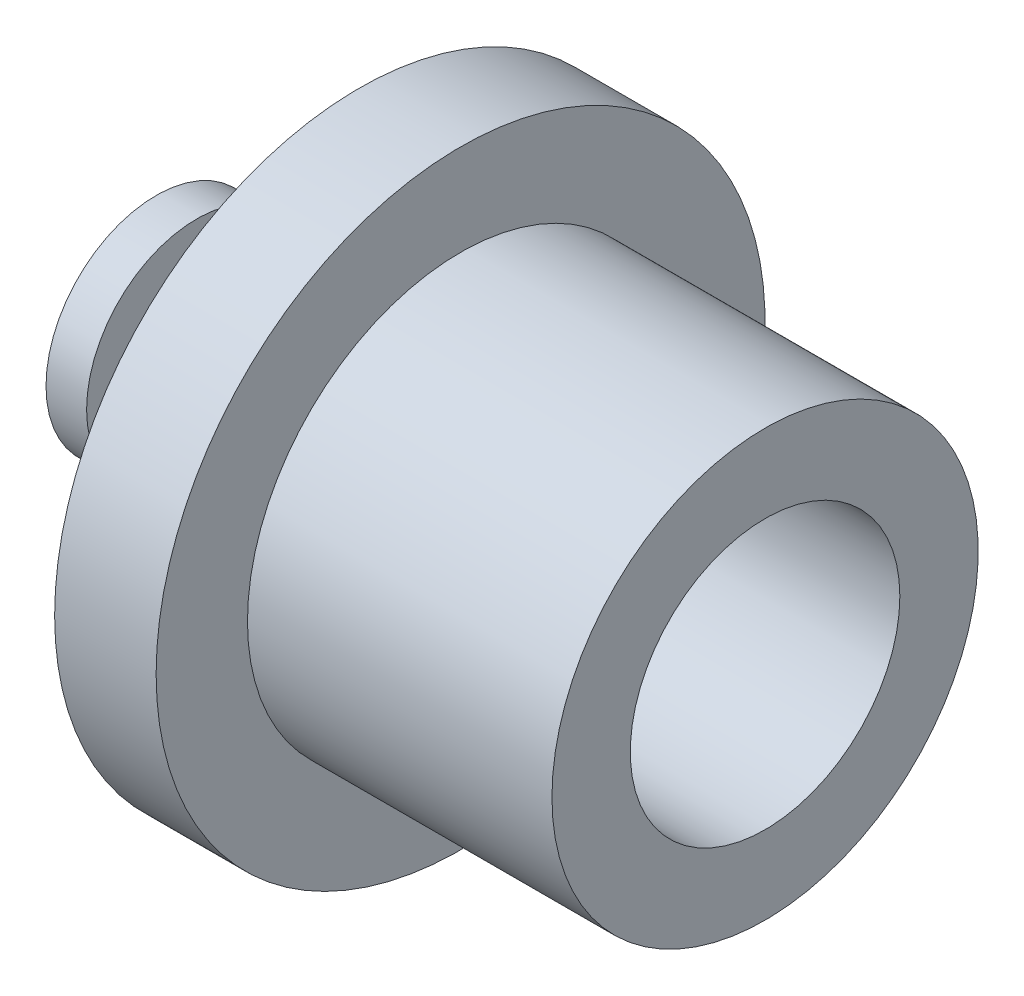
from build123d import *

# Parameters (mm, degrees)
PIPE_TAP_DRILL_FOR_1_8_TAP1_D       = 8.4328
PIPE_TAP_DRILL_FOR_1_8_TAP1_DEPTH   = 9.525
PIPE_TAP_DRILL_FOR_1_8_TAP1_TIP     = 2.533468714
F_3_32_0_09375_DIAMETER_HOLE2_D     = 2.38125
F_3_32_0_09375_DIAMETER_HOLE2_DEPTH = 12.7
F_3_32_0_09375_DIAMETER_HOLE2_TIP   = 0.715399675


with BuildPart() as part:
    # Sketch1 → Revolve1 (revolve)
    with BuildSketch(Plane.XY, mode=Mode.PRIVATE) as revolve1_sk:
        Polygon((6.35, 3.444875), (6.35, 9.525), (9.525, 9.525), (9.525, 6.6675), (19.05, 6.6675), (19.05, 0), (0, 0), (0, 3.444875), (1.27, 3.444875), (1.27, 2.073275), (3.81, 2.073275), (3.81, 3.444875), align=None)
    revolve(revolve1_sk.sketch.rotate(Axis((0, 0, 0), (1, 0, 0)), 90), axis=Axis((0, 0, 0), (1, 0, 0)))

    # Pipe Tap Drill for 1/8 Tap1
    with Locations(Plane(origin=(19.05, 0, 0), x_dir=(0, 0, -1), z_dir=(1, 0, 0))):
        with Locations((0, 0)):
            Hole(PIPE_TAP_DRILL_FOR_1_8_TAP1_D / 2, depth=PIPE_TAP_DRILL_FOR_1_8_TAP1_DEPTH)
            with Locations((0, 0, -(PIPE_TAP_DRILL_FOR_1_8_TAP1_DEPTH + PIPE_TAP_DRILL_FOR_1_8_TAP1_TIP / 2))):  # 118° drill point
                Cone(0, PIPE_TAP_DRILL_FOR_1_8_TAP1_D / 2, PIPE_TAP_DRILL_FOR_1_8_TAP1_TIP, mode=Mode.SUBTRACT)

    # 3/32 (0.09375) Diameter Hole2
    with Locations(Plane.ZY):
        with Locations((0, 0)):
            Hole(F_3_32_0_09375_DIAMETER_HOLE2_D / 2, depth=F_3_32_0_09375_DIAMETER_HOLE2_DEPTH)
            with Locations((0, 0, -(F_3_32_0_09375_DIAMETER_HOLE2_DEPTH + F_3_32_0_09375_DIAMETER_HOLE2_TIP / 2))):  # 118° drill point
                Cone(0, F_3_32_0_09375_DIAMETER_HOLE2_D / 2, F_3_32_0_09375_DIAMETER_HOLE2_TIP, mode=Mode.SUBTRACT)


solid = part.part
